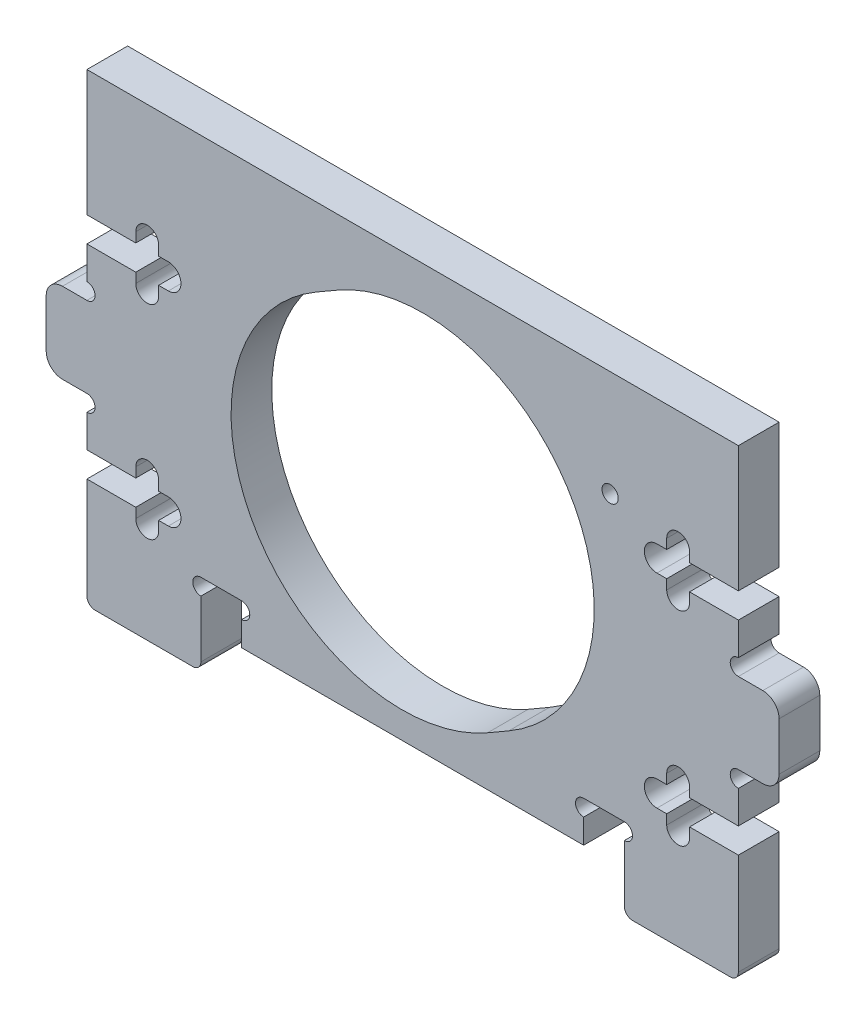
from build123d import *

# Parameters (mm, degrees)
SKETCH_1_W          = 80
SKETCH_1_H          = 52
EXTRUDE_1_DEPTH     = 5
CUT_EXTRUDE_3_DEPTH = 10
CUT_EXTRUDE_4_DEPTH = 10
SKETCH_9_R          = 1
CUT_EXTRUDE_5_DEPTH = 10
SKETCH_10_W         = 5
SKETCH_10_H         = 5
CUT_EXTRUDE_6_DEPTH = 10
SKETCH_11_R         = 1
CUT_EXTRUDE_7_DEPTH = 10
SKETCH_12_W         = 5
SKETCH_12_H         = 9.9
EXTRUDE_4_DEPTH     = 5
SKETCH_13_R         = 1
CUT_EXTRUDE_8_DEPTH = 5
FILLET_2_R          = 2
SKETCH_14_W         = 14
SKETCH_14_H         = 5
EXTRUDE_5_DEPTH     = 5
FILLET_3_R          = 1


with BuildPart() as part:
    # 스케치1 → 보스-돌출1 (new body)
    with BuildSketch(Plane.XY):
        with Locations((-10, -8.537755654)):
            Rectangle(SKETCH_1_W, SKETCH_1_H)
    extrude(amount=EXTRUDE_1_DEPTH)

    # 스케치7 → 컷-돌출3 (cut)
    with BuildSketch(Plane(origin=(0, 0, 0), x_dir=(-1, 0, 0), z_dir=(0, 0, -1))):
        with BuildLine():
            Line((-30, 2.012244346), (-24, 2.012244346))
            Line((-24, 2.012244346), (-24, 3.212244346))
            ThreePointArc((-24, 3.212244346), (-22.6, 4.612244346), (-21.2, 3.212244346))
            Line((-21.2, 3.212244346), (-21.2, 2.012244346))
            Line((-21.2, 2.012244346), (-20, 2.012244346))
            ThreePointArc((-20, 2.012244346), (-18.45, 0.462244346), (-20, -1.087755654))
            Line((-20, -1.087755654), (-21.2, -1.087755654))
            Line((-21.2, -1.087755654), (-21.2, -2.287755654))
            ThreePointArc((-21.2, -2.287755654), (-22.6, -3.687755654), (-24, -2.287755654))
            Line((-24, -2.287755654), (-24, -1.087755654))
            Line((-24, -1.087755654), (-30, -1.087755654))
            Line((-30, -1.087755654), (-30, 2.012244346))
        make_face()
        with BuildLine():
            Line((-30, -22.987755654), (-24, -22.987755654))
            Line((-24, -22.987755654), (-24, -21.787755654))
            ThreePointArc((-24, -21.787755654), (-22.6, -20.387755654), (-21.2, -21.787755654))
            Line((-21.2, -21.787755654), (-21.2, -22.987755654))
            Line((-21.2, -22.987755654), (-20, -22.987755654))
            ThreePointArc((-20, -22.987755654), (-18.45, -24.537755654), (-20, -26.087755654))
            Line((-20, -26.087755654), (-21.2, -26.087755654))
            Line((-21.2, -26.087755654), (-21.2, -27.287755654))
            ThreePointArc((-21.2, -27.287755654), (-22.6, -28.687755654), (-24, -27.287755654))
            Line((-24, -27.287755654), (-24, -26.087755654))
            Line((-24, -26.087755654), (-30, -26.087755654))
            Line((-30, -26.087755654), (-30, -22.987755654))
        make_face()
        with BuildLine():
            Line((44, -27.287755654), (44, -26.087755654))
            Line((44, -26.087755654), (50, -26.087755654))
            Line((50, -26.087755654), (50, -22.987755654))
            Line((50, -22.987755654), (44, -22.987755654))
            Line((44, -22.987755654), (44, -21.787755654))
            ThreePointArc((44, -21.787755654), (42.6, -20.387755654), (41.2, -21.787755654))
            Line((41.2, -21.787755654), (41.2, -22.987755654))
            Line((41.2, -22.987755654), (40, -22.987755654))
            ThreePointArc((40, -22.987755654), (38.45, -24.537755654), (40, -26.087755654))
            Line((40, -26.087755654), (41.2, -26.087755654))
            Line((41.2, -26.087755654), (41.2, -27.287755654))
            ThreePointArc((41.2, -27.287755654), (42.6, -28.687755654), (44, -27.287755654))
        make_face()
        with BuildLine():
            Line((44, -2.287755654), (44, -1.087755654))
            Line((44, -1.087755654), (50, -1.087755654))
            Line((50, -1.087755654), (50, 2.012244346))
            Line((50, 2.012244346), (44, 2.012244346))
            Line((44, 2.012244346), (44, 3.212244346))
            ThreePointArc((44, 3.212244346), (42.6, 4.612244346), (41.2, 3.212244346))
            Line((41.2, 3.212244346), (41.2, 2.012244346))
            Line((41.2, 2.012244346), (40, 2.012244346))
            ThreePointArc((40, 2.012244346), (38.45, 0.462244346), (40, -1.087755654))
            Line((40, -1.087755654), (41.2, -1.087755654))
            Line((41.2, -1.087755654), (41.2, -2.287755654))
            ThreePointArc((41.2, -2.287755654), (42.6, -3.687755654), (44, -2.287755654))
        make_face()
    extrude(amount=-CUT_EXTRUDE_3_DEPTH, mode=Mode.SUBTRACT)

    # 스케치8 → 컷-돌출4 (cut)
    with BuildSketch(Plane(origin=(0, 0, 0), x_dir=(-1, 0, 0), z_dir=(0, 0, -1))):
        with BuildLine():
            Line((19.200961894, 9.398777825), (21.799038106, 7.898777825))
            ThreePointArc((21.799038106, 7.898777825), (29.485571585, -20.787755654), (0.799038106, -28.474289134))
            Line((0.799038106, -28.474289134), (-1.799038106, -26.974289134))
            ThreePointArc((-1.799038106, -26.974289134), (-9.485571585, 1.712244346), (19.200961894, 9.398777825))
        make_face()
    extrude(amount=-CUT_EXTRUDE_4_DEPTH, mode=Mode.SUBTRACT)

    # 스케치9 → 컷-돌출5 (cut)
    with BuildSketch(Plane(origin=(0, 0, 0), x_dir=(-1, 0, 0), z_dir=(0, 0, -1))):
        with Locations((-14.248711306, 4.462244346)):
            Circle(SKETCH_9_R)
    extrude(amount=-CUT_EXTRUDE_5_DEPTH, mode=Mode.SUBTRACT)

    # 스케치10 → 컷-돌출6 (cut)
    with BuildSketch(Plane.XY.offset(5)):
        with Locations((13.5, -32.037755654)):
            Rectangle(SKETCH_10_W, SKETCH_10_H)
        with Locations((-33.5, -32.037755654)):
            Rectangle(SKETCH_10_W, SKETCH_10_H)
    extrude(amount=-CUT_EXTRUDE_6_DEPTH, mode=Mode.SUBTRACT)

    # 스케치11 → 컷-돌출7 (cut)
    with BuildSketch(Plane(origin=(0, 0, 0), x_dir=(-1, 0, 0), z_dir=(0, 0, -1))):
        with Locations((-11, -30.537755654)):
            Circle(SKETCH_11_R)
        with Locations((-16, -30.537755654)):
            Circle(SKETCH_11_R)
        with Locations((31, -30.537755654)):
            Circle(SKETCH_11_R)
        with Locations((36, -30.537755654)):
            Circle(SKETCH_11_R)
    extrude(amount=-CUT_EXTRUDE_7_DEPTH, mode=Mode.SUBTRACT)

    # 스케치12 → 보스-돌출4 (add)
    with BuildSketch(Plane(origin=(0, 0, 0), x_dir=(-1, 0, 0), z_dir=(0, 0, -1))):
        with Locations((52.5, -12.037755654)):
            Rectangle(SKETCH_12_W, SKETCH_12_H)
        with Locations((-32.5, -12.037755654)):
            Rectangle(SKETCH_12_W, SKETCH_12_H)
    extrude(amount=-EXTRUDE_4_DEPTH)

    # 스케치13 → 컷-돌출8 (cut)
    with BuildSketch(Plane(origin=(0, 0, 0), x_dir=(-1, 0, 0), z_dir=(0, 0, -1))):
        with Locations((50, -6.087755654)):
            Circle(SKETCH_13_R)
        with Locations((50, -17.987755654)):
            Circle(SKETCH_13_R)
        with Locations((-30, -6.087755654)):
            Circle(SKETCH_13_R)
        with Locations((-30, -17.987755654)):
            Circle(SKETCH_13_R)
    extrude(amount=-CUT_EXTRUDE_8_DEPTH, mode=Mode.SUBTRACT)

    # 필렛2
    fillet_2_edges = [part.edges().sort_by_distance(p)[0] for p in [
        (-55, -7.087755654, 2.5),
        (-55, -16.987755654, 2.5),
        (35, -7.087755654, 2.5),
        (35, -16.987755654, 2.5),
    ]]
    fillet(fillet_2_edges, radius=FILLET_2_R)

    # 스케치14 → 보스-돌출5 (add)
    with BuildSketch(Plane(origin=(0, 0, 0), x_dir=(-1, 0, 0), z_dir=(0, 0, -1))):
        with Locations((43, -37.037755654)):
            Rectangle(SKETCH_14_W, SKETCH_14_H)
        with Locations((-23, -37.037755654)):
            Rectangle(SKETCH_14_W, SKETCH_14_H)
    extrude(amount=-EXTRUDE_5_DEPTH)

    # 필렛3
    fillet_3_edges = [part.edges().sort_by_distance(p)[0] for p in [
        (-50, -39.537755654, 2.5),
        (-36, -39.537755654, 2.5),
        (16, -39.537755654, 2.5),
        (30, -39.537755654, 2.5),
    ]]
    fillet(fillet_3_edges, radius=FILLET_3_R)


solid = part.part
